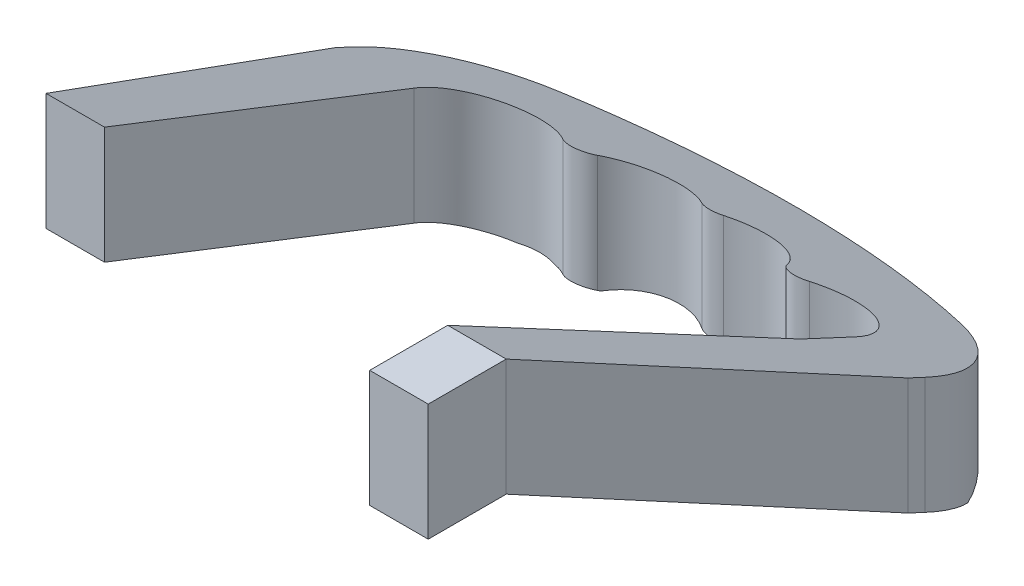
from build123d import *

# Parameters (mm, degrees)
SKETCH1_W               = 9.525
SKETCH1_H               = 19.05
BOSS_EXTRUDE1_DEPTH     = 12.7
BOSS_EXTRUDE2_DEPTH     = 50.8
CUT_EXTRUDE1_DEPTH      = 114.668287772
CUT_EXTRUDE1_DEPTH_BACK = 114.668287772


with BuildPart() as part:
    # Sketch1 → Boss-Extrude1 (new body)
    with BuildSketch(Plane.XY):
        with Locations((32.7025, 4.948874545)):
            Rectangle(SKETCH1_W, SKETCH1_H)
    extrude(amount=-BOSS_EXTRUDE1_DEPTH)

    # Sketch2 → Boss-Extrude2 (add)
    with BuildSketch(Plane(origin=(0, 14.473874545, 0), x_dir=(1, 0, 0), z_dir=(0, 1, 0))):
        with BuildLine():
            ThreePointArc((46.582827663, 71.746075344), (42.767883123, 83.788084157), (32.714892878, 91.436689602))
            ThreePointArc((32.714892878, 91.436689602), (0, 97.112987913), (-32.714892878, 91.436689602))
            ThreePointArc((-32.714892878, 91.436689602), (-42.767883123, 83.788084157), (-46.582827663, 71.746075344))
            Line((-46.582827663, 71.746075344), (-46.582827663, 68.977736354))
            Line((-46.582827663, 68.977736354), (-37.465, 12.7))
            Line((-37.465, 12.7), (-27.94, 12.7))
            Line((-27.94, 12.7), (-35.072238217, 70.222747392))
            ThreePointArc((-35.072238217, 70.222747392), (-30.65501556, 79.862333542), (-20.059817821, 79.443690492))
            ThreePointArc((-20.059817821, 79.443690492), (-17.502300297, 78.909892112), (-15.410312677, 80.474955814))
            ThreePointArc((-15.410312677, 80.474955814), (-9.316307054, 85.127912481), (-1.767954793, 83.782814559))
            ThreePointArc((-1.767954793, 83.782814559), (0, 83.245040535), (1.767954793, 83.782814559))
            ThreePointArc((1.767954793, 83.782814559), (9.316307054, 85.127912481), (15.410312677, 80.474955814))
            ThreePointArc((15.410312677, 80.474955814), (17.502300297, 78.909892112), (20.059817821, 79.443690492))
            ThreePointArc((20.059817821, 79.443690492), (29.98783501, 80.23610137), (35.194839749, 71.746075344))
            Line((35.194839749, 71.746075344), (35.194839749, 62.905769869))
            Line((35.194839749, 62.905769869), (27.94, 12.7))
            Line((27.94, 12.7), (37.465, 12.7))
            Line((37.465, 12.7), (46.582827663, 68.977736354))
            Line((46.582827663, 68.977736354), (46.582827663, 71.746075344))
        make_face()
    extrude(amount=-BOSS_EXTRUDE2_DEPTH)

    # Sketch3 → Cut-Extrude1 (cut, two sides: drawn at the far end of the back side and taken through both)
    with BuildSketch(Plane(origin=(0, 0, 0), x_dir=(0, 0, -1), z_dir=(1, 0, 0)).offset(-CUT_EXTRUDE1_DEPTH_BACK)):
        Polygon((80.788094726, -36.326125455), (12.7, -4.576125455), (12.7, -36.326125455), align=None)
        Polygon((97.112987913, -24.888548166), (12.7, 14.473874545), (97.112987913, 14.473874545), align=None)
    extrude(amount=CUT_EXTRUDE1_DEPTH + CUT_EXTRUDE1_DEPTH_BACK, mode=Mode.SUBTRACT)


solid = part.part
